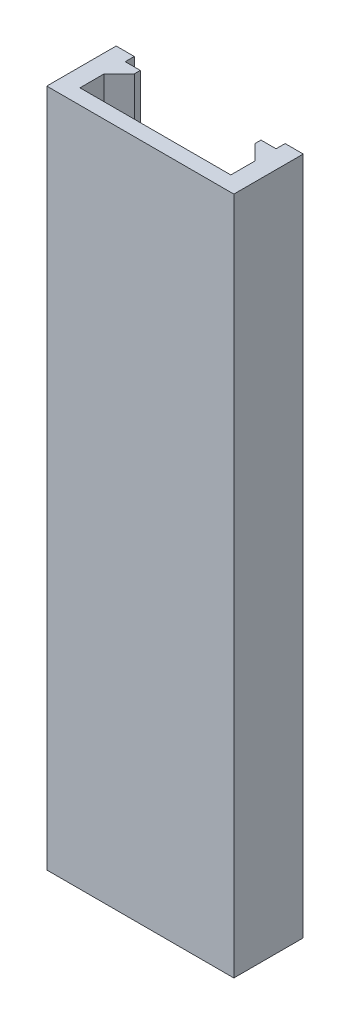
from build123d import *

# Parameters (mm, degrees)
P_IDAT_VYSUNUT_M1_DEPTH = 45


with BuildPart() as part:
    # Skica1 → Přidat vysunutím1 (new body)
    with BuildSketch(Plane(origin=(0, 0, 0), x_dir=(1, 0, 0), z_dir=(0, 1, 0))):
        Polygon((-5, 0), (5, 0), (5, 1.6), (4, 2.6), (4, 3), (5, 3), (5, 3.6), (6.2, 3.6), (6.2, -1), (-6.2, -1), (-6.2, 3.6), (-5, 3.6), (-5, 3), (-4, 3), (-4, 2.6), (-5, 1.6), align=None)
    extrude(amount=P_IDAT_VYSUNUT_M1_DEPTH)


solid = part.part
